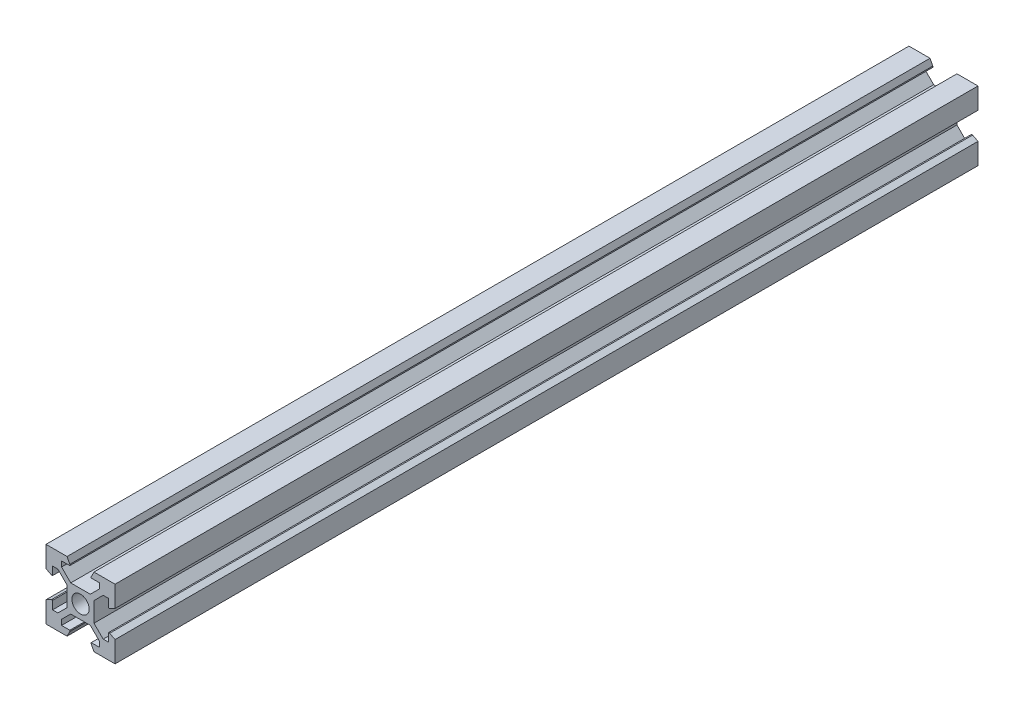
from build123d import *

# Parameters (mm, degrees)
SKETCH1_R           = 2.5
BOSS_EXTRUDE1_DEPTH = 250


with BuildPart() as part:
    # Sketch1 → Boss-Extrude1 (new body)
    with BuildSketch(Plane.XY):
        Polygon((6.1, 20), (0, 20), (0, 13.895792909), (1.56, 13.1), (1.9, 13.1), (1.9, 15.5), (3.439339828, 15.5), (6.1, 12.839339828), (6.1, 7.160660172), (3.439339828, 4.5), (1.9, 4.5), (1.9, 6.9), (1.56, 6.9), (0, 6.104207091), (0, 0), (6.1, 0), (6.9, 1.56), (6.9, 1.9), (4.5, 1.9), (4.5, 3.439339828), (7.160660172, 6.1), (12.839339828, 6.1), (15.5, 3.439339828), (15.5, 1.9), (13.1, 1.9), (13.1, 1.56), (13.9, 0), (20, 0), (20, 6.104207091), (18.44, 6.9), (18.1, 6.9), (18.1, 4.5), (16.560660172, 4.5), (13.9, 7.160660172), (13.9, 12.839339828), (16.560660172, 15.5), (18.1, 15.5), (18.1, 13.1), (18.44, 13.1), (20, 13.895792909), (20, 20), (13.9, 20), (13.1, 18.44), (13.1, 18.1), (15.5, 18.1), (15.5, 16.560660172), (12.839339828, 13.9), (7.160660172, 13.9), (4.5, 16.560660172), (4.5, 18.1), (6.9, 18.1), (6.9, 18.44), align=None)
        with Locations((10, 10)):
            Circle(SKETCH1_R, mode=Mode.SUBTRACT)
    extrude(amount=BOSS_EXTRUDE1_DEPTH)


solid = part.part
